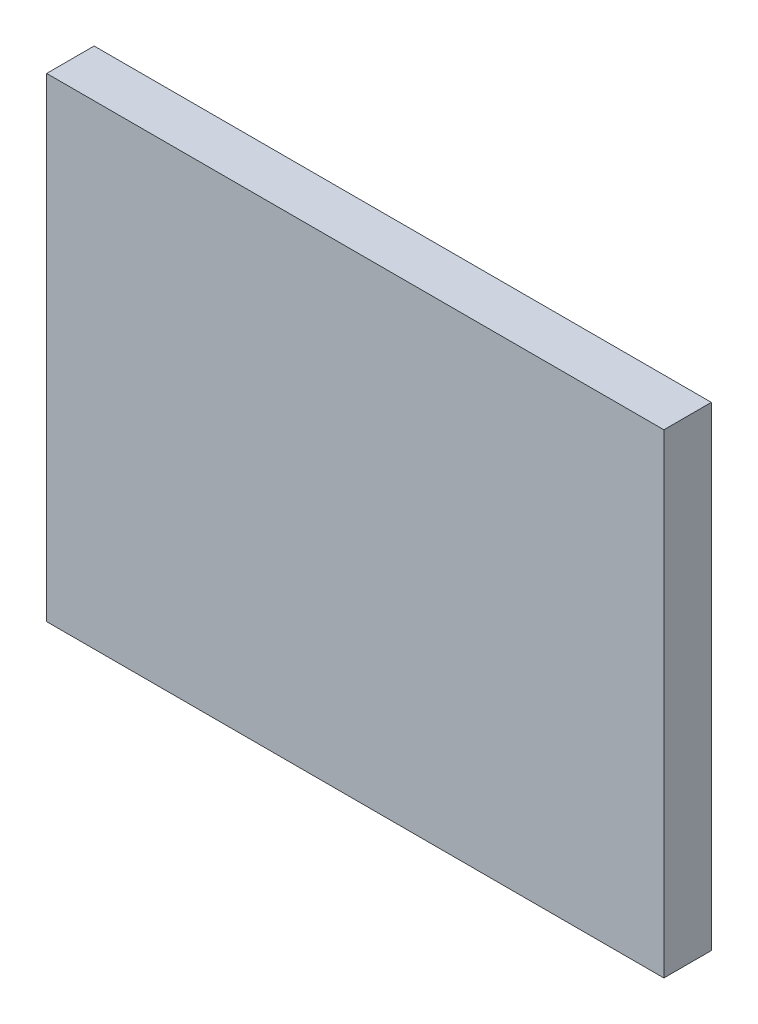
from build123d import *

# Parameters (mm, degrees)
ESQUISSE1_W        = 130
ESQUISSE1_H        = 100
BOSS_EXTRU_1_DEPTH = 10


with BuildPart() as part:
    # Esquisse1 → Boss.-Extru.1 (new body)
    with BuildSketch(Plane.XY):
        with Locations((-23.451334335, 50)):
            Rectangle(ESQUISSE1_W, ESQUISSE1_H)
    extrude(amount=BOSS_EXTRU_1_DEPTH)


solid = part.part
